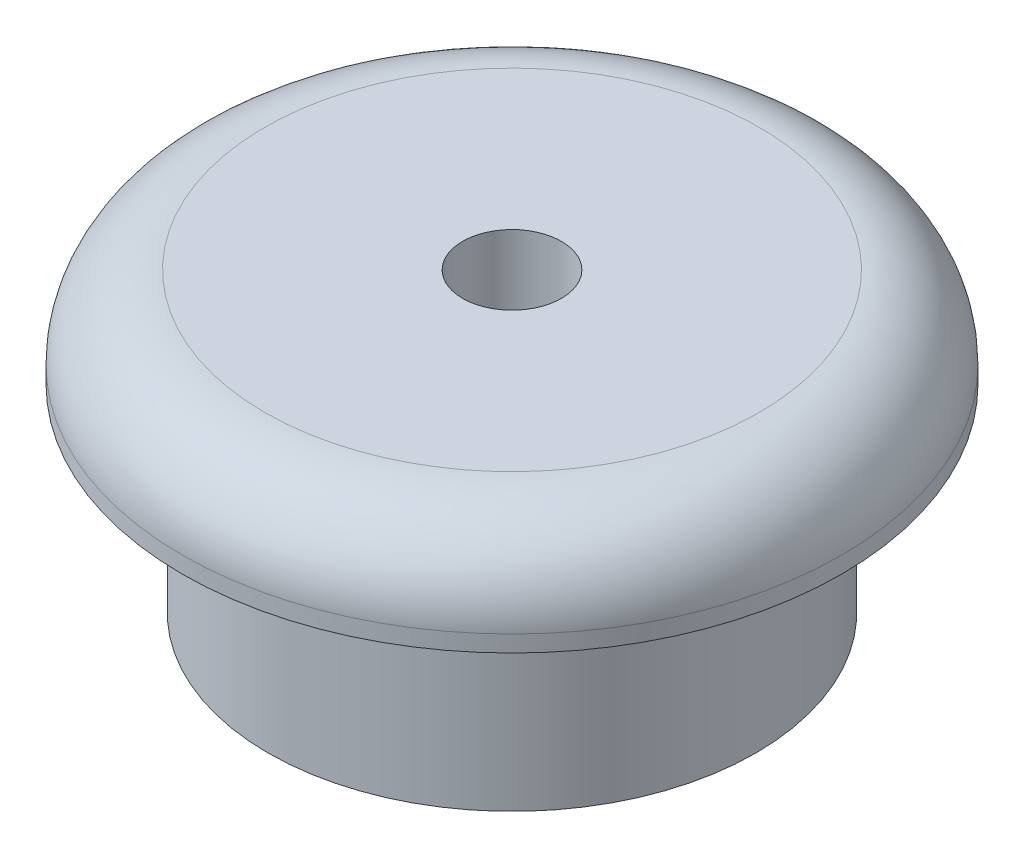
from build123d import *

# Parameters (mm, degrees)
SKETCH1_R           = 7.4
BOSS_EXTRUDE1_DEPTH = 6
SKETCH2_R           = 10
SKETCH2_R_2         = 1.5
BOSS_EXTRUDE2_DEPTH = 3
FILLET1_R           = 2.5


with BuildPart() as part:
    # Sketch1 → Boss-Extrude1 (new body)
    with BuildSketch(Plane(origin=(0, 0, 0), x_dir=(1, 0, 0), z_dir=(0, 1, 0))):
        with Locations(Location((0, 0, 0), (0, 0, 270))):
            Circle(SKETCH1_R)
        with BuildLine():
            Line((2.2, 2.219374912), (2.2, -2.219374912))
            ThreePointArc((2.2, -2.219374912), (-3.125, 0), (2.2, 2.219374912))
        make_face(mode=Mode.SUBTRACT)
    extrude(amount=BOSS_EXTRUDE1_DEPTH)

    # Sketch2 → Boss-Extrude2 (add)
    with BuildSketch(Plane(origin=(0, 6, 0), x_dir=(1, 0, 0), z_dir=(0, 1, 0))):
        with Locations(Location((0, 0, 0), (0, 0, 270))):
            Circle(SKETCH2_R)
        with Locations(Location((0, 0, 0), (0, 0, 270))):
            Circle(SKETCH2_R_2, mode=Mode.SUBTRACT)
    extrude(amount=BOSS_EXTRUDE2_DEPTH)

    # Fillet1
    fillet1_edges = [part.edges().sort_by_distance(p)[0] for p in [
        (0, 9, -10),
    ]]
    fillet(fillet1_edges, radius=FILLET1_R)


solid = part.part
